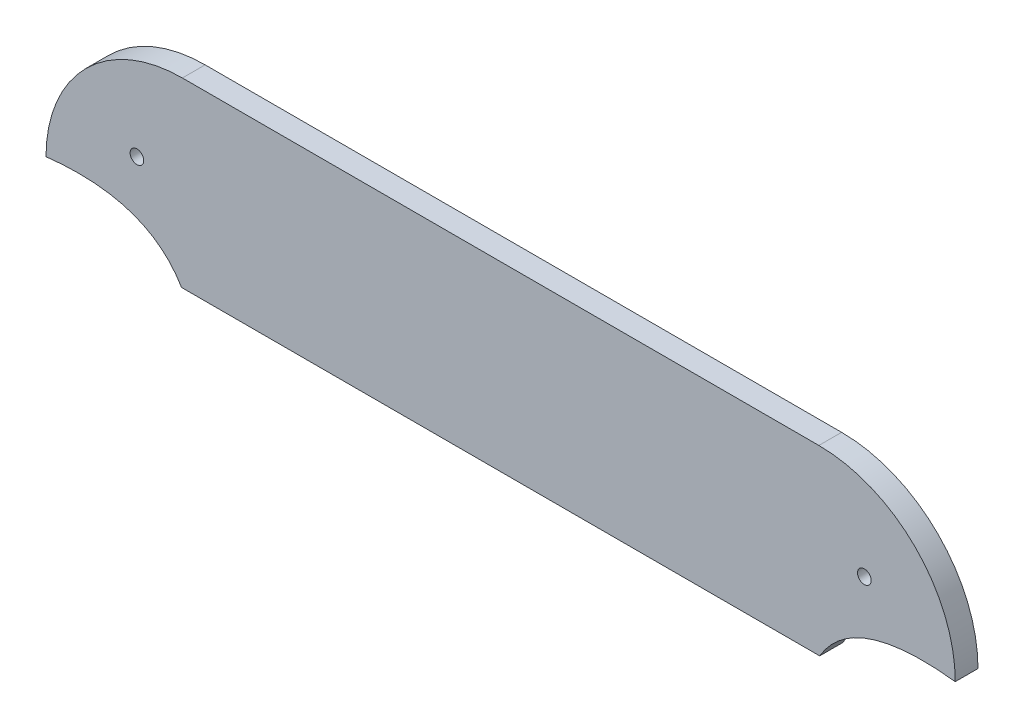
from build123d import *

# Parameters (mm, degrees)
BOSS_EXTRUDE1_DEPTH = 5
SKETCH2_W           = 30
SKETCH2_H           = 70
CUT_EXTRUDE1_DEPTH  = 5
CUT_EXTRUDE2_DEPTH  = 5
SKETCH5_R           = 2.5
CUT_EXTRUDE3_DEPTH  = 5
SKETCH6_R           = 2.5
CUT_EXTRUDE4_DEPTH  = 5
CUT_EXTRUDE5_DEPTH  = 5
SKETCH8_R           = 1.5
CUT_EXTRUDE6_DEPTH  = 5


with BuildPart() as part:
    # Sketch1 → Boss-Extrude1 (new body)
    with BuildSketch(Plane.XY):
        with BuildLine():
            Line((-90, -100), (90, -100))
            ThreePointArc((90, -100), (97.071067812, -97.071067812), (100, -90))
            Line((100, -90), (100, 70))
            ThreePointArc((100, 70), (91.213203436, 91.213203436), (70, 100))
            Line((70, 100), (-70, 100))
            ThreePointArc((-70, 100), (-91.213203436, 91.213203436), (-100, 70))
            Line((-100, 70), (-100, -90))
            ThreePointArc((-100, -90), (-97.071067812, -97.071067812), (-90, -100))
        make_face()
    extrude(amount=BOSS_EXTRUDE1_DEPTH)

    # Sketch2 → Cut-Extrude1 (cut)
    with BuildSketch(Plane.XY.offset(5)):
        with Locations((85, -55)):
            Rectangle(SKETCH2_W, SKETCH2_H)
        with Locations((-85, -55)):
            Rectangle(SKETCH2_W, SKETCH2_H)
    extrude(amount=-CUT_EXTRUDE1_DEPTH, mode=Mode.SUBTRACT)

    # Sketch3 → Cut-Extrude2 (cut)
    with BuildSketch(Plane.XY.offset(5)):
        with BuildLine():
            Line((85, -20), (100, -20))
            Line((100, -20), (100, 70))
            add(Edge.make_bspline(
                [(100, 70), (41.562750789, 76.769648156), (85, -20)],
                knots=[0, 0, 0, 1, 1, 1], degree=2))
        make_face()
        with BuildLine():
            Line((-85, -20), (-100, -20))
            Line((-100, -20), (-100, 70))
            add(Edge.make_bspline(
                [(-100, 70), (-41.562750789, 76.769648156), (-85, -20)],
                knots=[0, 0, 0, 1, 1, 1], degree=2))
        make_face()
    extrude(amount=-CUT_EXTRUDE2_DEPTH, mode=Mode.SUBTRACT)

    # Sketch5 → Cut-Extrude3 (cut)
    with BuildSketch(Plane.XY.offset(5)):
        with Locations((50, -80)):
            Circle(SKETCH5_R)
        with Locations((-50, -80)):
            Circle(SKETCH5_R)
        with Locations(Location((50, -20, 0), (0, 0, 180))):
            Circle(SKETCH5_R)
        with Locations(Location((-50, -20, 0), (0, 0, 180))):
            Circle(SKETCH5_R)
    extrude(amount=-CUT_EXTRUDE3_DEPTH, mode=Mode.SUBTRACT)

    # Sketch6 → Cut-Extrude4 (cut)
    with BuildSketch(Plane.XY.offset(5)):
        with Locations((0, -90)):
            Circle(SKETCH6_R)
    extrude(amount=-CUT_EXTRUDE4_DEPTH, mode=Mode.SUBTRACT)

    # Sketch7 → Cut-Extrude5 (cut)
    with BuildSketch(Plane.XY.offset(5)):
        Polygon((-70.182426877, 60), (70.182426877, 60), (160.134720298, 60), (160.134720298, -117.07554651), (-141.914902021, -117.07554651), (-141.914902021, 60), align=None)
    extrude(amount=-CUT_EXTRUDE5_DEPTH, mode=Mode.SUBTRACT)

    # Sketch8 → Cut-Extrude6 (cut)
    with BuildSketch(Plane.XY.offset(5)):
        with Locations((-80, 80)):
            Circle(SKETCH8_R)
        with Locations((80, 80)):
            Circle(SKETCH8_R)
    extrude(amount=-CUT_EXTRUDE6_DEPTH, mode=Mode.SUBTRACT)


solid = part.part
